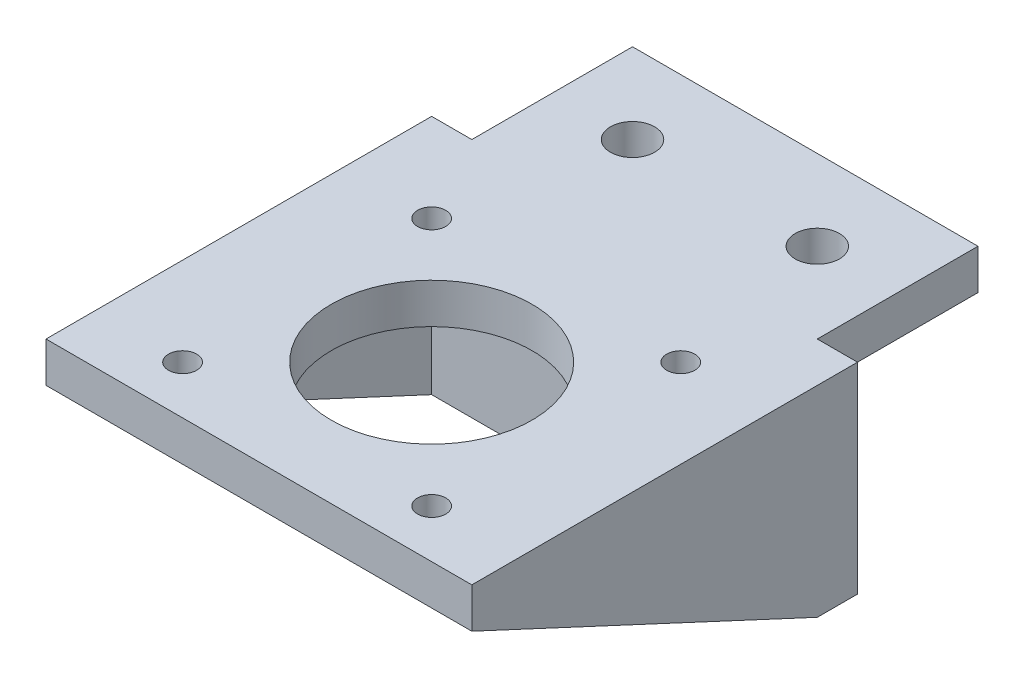
from build123d import *

# Parameters (mm, degrees)
SKETCH_1_W          = 43
SKETCH_1_H          = 43
SKETCH_1_R          = 1.75
SKETCH_1_R_2        = 12.5
EXTRUDE_1_DEPTH     = 5
SKETCH_2_W          = 43
SKETCH_2_H          = 5
EXTRUDE_2_DEPTH     = 25
SKETCH_3_W          = 43
SKETCH_3_H          = 5
EXTRUDE_3_DEPTH     = 20
EXTRUDE_4_DEPTH     = 5
EXTRUDE_6_DEPTH     = 5
SKETCH_10_R         = 2.75
CUT_EXTRUDE_1_DEPTH = 55.385549855


with BuildPart() as part:
    # 草图1 → 凸台-拉伸1 (new body)
    with BuildSketch(Plane(origin=(0, 0, 0), x_dir=(1, 0, 0), z_dir=(0, 1, 0))):
        with Locations((6.376567293, -11.117527558)):
            Rectangle(SKETCH_1_W, SKETCH_1_H)
        with Locations(Location((-9.123432707, -26.617527558, 0), (0, 0, 270))):
            Circle(SKETCH_1_R, mode=Mode.SUBTRACT)
        with Locations(Location((21.876567293, -26.617527558, 0), (0, 0, 270))):
            Circle(SKETCH_1_R, mode=Mode.SUBTRACT)
        with Locations(Location((21.876567293, 4.382472442, 0), (0, 0, 270))):
            Circle(SKETCH_1_R, mode=Mode.SUBTRACT)
        with Locations(Location((-9.123432707, 4.382472442, 0), (0, 0, 270))):
            Circle(SKETCH_1_R, mode=Mode.SUBTRACT)
        with Locations(Location((6.376567293, -11.117527558, 0), (0, 0, 270))):
            Circle(SKETCH_1_R_2, mode=Mode.SUBTRACT)
    extrude(amount=EXTRUDE_1_DEPTH)

    # 草图2 → 凸台-拉伸2 (add)
    with BuildSketch(Plane(origin=(0, 0, -10.382472442), x_dir=(-1, 0, 0), z_dir=(0, 0, -1))):
        with Locations((-6.376567293, 2.5)):
            Rectangle(SKETCH_2_W, SKETCH_2_H)
    extrude(amount=EXTRUDE_2_DEPTH)

    # 草图3 → 凸台-拉伸3 (add)
    with BuildSketch(Plane.XZ):
        with Locations((6.376567293, -12.882472442)):
            Rectangle(SKETCH_3_W, SKETCH_3_H)
    extrude(amount=EXTRUDE_3_DEPTH)

    # 草图4 → 凸台-拉伸4 (add)
    with BuildSketch(Plane(origin=(27.876567293, 0, 0), x_dir=(0, 0, -1), z_dir=(1, 0, 0))):
        Polygon((-32.617527558, 0), (10.382472442, -20), (15.382472442, -20), (15.382472442, 5), (-32.617527558, 5), align=None)
    extrude(amount=EXTRUDE_4_DEPTH)

    # 草图9 → 凸台-拉伸6 (add)
    with BuildSketch(Plane.ZY.offset(15.123432707)):
        Polygon((32.617527558, 5), (32.617527558, 0), (-10.382472442, -20), (-15.382472442, -20), (-15.382472442, 5), align=None)
    extrude(amount=EXTRUDE_6_DEPTH)

    # 草图10 → 切除-拉伸1 (cut, through all)
    with BuildSketch(Plane(origin=(0, 5, 0), x_dir=(1, 0, 0), z_dir=(0, 1, 0))):
        with Locations(Location((-5.123432707, 25.382472442, 0), (0, 0, 270))):
            Circle(SKETCH_10_R)
        with Locations(Location((17.876567293, 25.382472442, 0), (0, 0, 270))):
            Circle(SKETCH_10_R)
    extrude(amount=-CUT_EXTRUDE_1_DEPTH, mode=Mode.SUBTRACT)


solid = part.part
